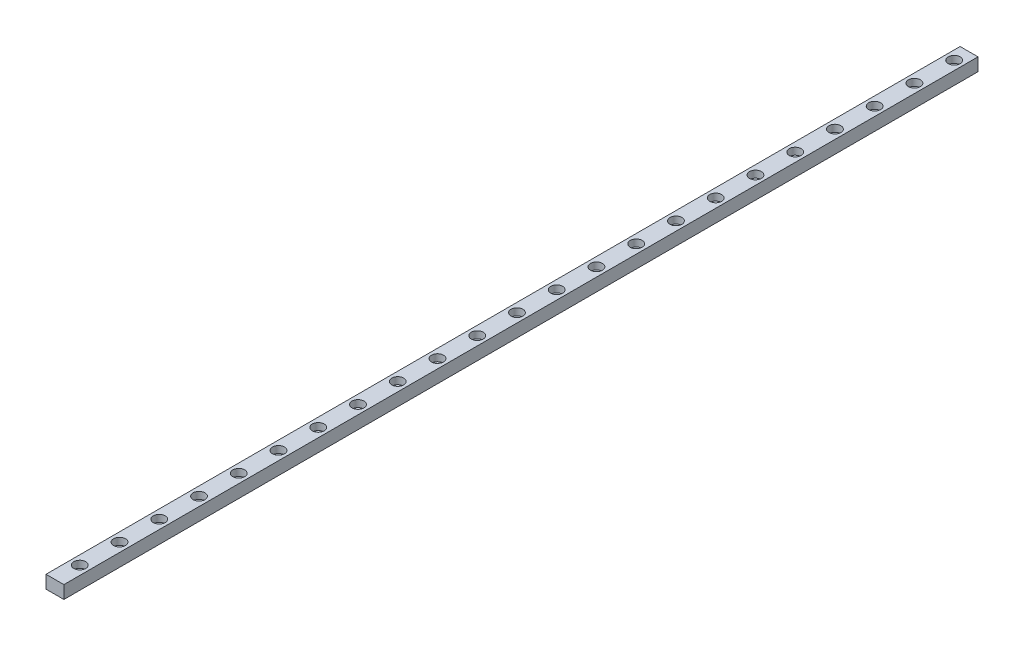
from build123d import *

# Parameters (mm, degrees)
SKETCH_1_W          = 9
SKETCH_1_H          = 6.5
EXTRUDE_1_DEPTH     = 460
SKETCH_2_R          = 1.750000006
CUT_EXTRUDE_1_DEPTH = 371.819449874
SKETCH_3_R          = 3.000000006
CUT_EXTRUDE_2_DEPTH = 3.5


with BuildPart() as part:
    # 草图1 → 凸台-拉伸1 (new body)
    with BuildSketch(Plane.XY.offset(-89.264832522)):
        Rectangle(SKETCH_1_W, SKETCH_1_H)
    extrude(amount=EXTRUDE_1_DEPTH)

    # 草图2 → 切除-拉伸1 (cut, through all)
    with BuildSketch(Plane(origin=(0, 3.25, 0), x_dir=(1, 0, 0), z_dir=(0, 1, 0))):
        with Locations(Location((0, 81.764832522, 0), (0, 0, 270))):
            Circle(SKETCH_2_R)
        with Locations(Location((0, 61.764832522, 0), (0, 0, 270))):
            Circle(SKETCH_2_R)
        with Locations(Location((0, 41.764832522, 0), (0, 0, 270))):
            Circle(SKETCH_2_R)
        with Locations(Location((0, 21.764832522, 0), (0, 0, 270))):
            Circle(SKETCH_2_R)
        with Locations(Location((0, 1.764832522, 0), (0, 0, 270))):
            Circle(SKETCH_2_R)
        with Locations(Location((0, -18.235167478, 0), (0, 0, 270))):
            Circle(SKETCH_2_R)
        with Locations(Location((0, -38.235167478, 0), (0, 0, 270))):
            Circle(SKETCH_2_R)
        with Locations(Location((0, -58.235167478, 0), (0, 0, 270))):
            Circle(SKETCH_2_R)
        with Locations(Location((0, -78.235167478, 0), (0, 0, 270))):
            Circle(SKETCH_2_R)
        with Locations(Location((0, -98.235167478, 0), (0, 0, 270))):
            Circle(SKETCH_2_R)
        with Locations(Location((0, -118.235167478, 0), (0, 0, 270))):
            Circle(SKETCH_2_R)
        with Locations(Location((0, -138.235167478, 0), (0, 0, 270))):
            Circle(SKETCH_2_R)
        with Locations(Location((0, -158.235167478, 0), (0, 0, 270))):
            Circle(SKETCH_2_R)
        with Locations(Location((0, -178.235167478, 0), (0, 0, 270))):
            Circle(SKETCH_2_R)
        with Locations(Location((0, -198.235167478, 0), (0, 0, 270))):
            Circle(SKETCH_2_R)
        with Locations(Location((0, -218.235167478, 0), (0, 0, 270))):
            Circle(SKETCH_2_R)
        with Locations(Location((0, -238.235167478, 0), (0, 0, 270))):
            Circle(SKETCH_2_R)
        with Locations(Location((0, -258.235167478, 0), (0, 0, 270))):
            Circle(SKETCH_2_R)
        with Locations(Location((0, -278.235167478, 0), (0, 0, 270))):
            Circle(SKETCH_2_R)
        with Locations(Location((0, -298.235167478, 0), (0, 0, 270))):
            Circle(SKETCH_2_R)
        with Locations(Location((0, -318.235167478, 0), (0, 0, 270))):
            Circle(SKETCH_2_R)
        with Locations(Location((0, -338.235167478, 0), (0, 0, 270))):
            Circle(SKETCH_2_R)
        with Locations(Location((0, -358.235167478, 0), (0, 0, 270))):
            Circle(SKETCH_2_R)
        with Locations((0, -378.235167478)):
            Circle(SKETCH_2_R)
        with Locations((0, -398.235167478)):
            Circle(SKETCH_2_R)
        with Locations((0, -418.235167478)):
            Circle(SKETCH_2_R)
        with Locations((0, -438.235167478)):
            Circle(SKETCH_2_R)
        with Locations((0, -458.235167478)):
            Circle(SKETCH_2_R)
        with Locations((0, -478.235167478)):
            Circle(SKETCH_2_R)
        with Locations((0, -498.235167478)):
            Circle(SKETCH_2_R)
        with Locations((0, -518.235167478)):
            Circle(SKETCH_2_R)
        with Locations((0, -538.235167478)):
            Circle(SKETCH_2_R)
        with Locations((0, -558.235167478)):
            Circle(SKETCH_2_R)
        with Locations((0, -578.235167478)):
            Circle(SKETCH_2_R)
        with Locations((0, -598.235167478)):
            Circle(SKETCH_2_R)
        with Locations((0, -618.235167478)):
            Circle(SKETCH_2_R)
        with Locations((0, -638.235167478)):
            Circle(SKETCH_2_R)
        with Locations((0, -658.235167478)):
            Circle(SKETCH_2_R)
        with Locations((0, -678.235167478)):
            Circle(SKETCH_2_R)
        with Locations((0, -698.235167478)):
            Circle(SKETCH_2_R)
        with Locations((0, -718.235167478)):
            Circle(SKETCH_2_R)
        with Locations((0, -738.235167478)):
            Circle(SKETCH_2_R)
        with Locations((0, -758.235167478)):
            Circle(SKETCH_2_R)
        with Locations((0, -778.235167478)):
            Circle(SKETCH_2_R)
        with Locations((0, -798.235167478)):
            Circle(SKETCH_2_R)
        with Locations((0, -818.235167478)):
            Circle(SKETCH_2_R)
        with Locations((0, -838.235167478)):
            Circle(SKETCH_2_R)
        with Locations((0, -858.235167478)):
            Circle(SKETCH_2_R)
        with Locations((0, -878.235167478)):
            Circle(SKETCH_2_R)
        with Locations((0, -898.235167478)):
            Circle(SKETCH_2_R)
        with Locations((0, -918.235167478)):
            Circle(SKETCH_2_R)
        with Locations((0, -938.235167478)):
            Circle(SKETCH_2_R)
        with Locations((0, -958.235167478)):
            Circle(SKETCH_2_R)
        with Locations((0, -978.235167478)):
            Circle(SKETCH_2_R)
        with Locations((0, -998.235167478)):
            Circle(SKETCH_2_R)
        with Locations((0, -1018.235167478)):
            Circle(SKETCH_2_R)
        with Locations((0, -1038.235167478)):
            Circle(SKETCH_2_R)
        with Locations((0, -1058.235167478)):
            Circle(SKETCH_2_R)
        with Locations((0, -1078.235167478)):
            Circle(SKETCH_2_R)
        with Locations((0, -1098.235167478)):
            Circle(SKETCH_2_R)
    extrude(amount=-CUT_EXTRUDE_1_DEPTH, mode=Mode.SUBTRACT)

    # 草图3 → 切除-拉伸2 (cut)
    with BuildSketch(Plane(origin=(0, 3.25, 0), x_dir=(1, 0, 0), z_dir=(0, 1, 0))):
        with Locations(Location((0, 81.764832522, 0), (0, 0, 270))):
            Circle(SKETCH_3_R)
        with Locations(Location((0, 61.764832522, 0), (0, 0, 270))):
            Circle(SKETCH_3_R)
        with Locations(Location((0, 41.764832522, 0), (0, 0, 270))):
            Circle(SKETCH_3_R)
        with Locations(Location((0, 21.764832522, 0), (0, 0, 270))):
            Circle(SKETCH_3_R)
        with Locations(Location((0, 1.764832522, 0), (0, 0, 270))):
            Circle(SKETCH_3_R)
        with Locations(Location((0, -18.235167478, 0), (0, 0, 270))):
            Circle(SKETCH_3_R)
        with Locations(Location((0, -38.235167478, 0), (0, 0, 270))):
            Circle(SKETCH_3_R)
        with Locations(Location((0, -58.235167478, 0), (0, 0, 270))):
            Circle(SKETCH_3_R)
        with Locations(Location((0, -78.235167478, 0), (0, 0, 270))):
            Circle(SKETCH_3_R)
        with Locations(Location((0, -98.235167478, 0), (0, 0, 270))):
            Circle(SKETCH_3_R)
        with Locations(Location((0, -118.235167478, 0), (0, 0, 270))):
            Circle(SKETCH_3_R)
        with Locations(Location((0, -138.235167478, 0), (0, 0, 270))):
            Circle(SKETCH_3_R)
        with Locations(Location((0, -158.235167478, 0), (0, 0, 270))):
            Circle(SKETCH_3_R)
        with Locations(Location((0, -178.235167478, 0), (0, 0, 270))):
            Circle(SKETCH_3_R)
        with Locations(Location((0, -198.235167478, 0), (0, 0, 270))):
            Circle(SKETCH_3_R)
        with Locations(Location((0, -218.235167478, 0), (0, 0, 270))):
            Circle(SKETCH_3_R)
        with Locations(Location((0, -238.235167478, 0), (0, 0, 270))):
            Circle(SKETCH_3_R)
        with Locations(Location((0, -258.235167478, 0), (0, 0, 270))):
            Circle(SKETCH_3_R)
        with Locations(Location((0, -278.235167478, 0), (0, 0, 270))):
            Circle(SKETCH_3_R)
        with Locations(Location((0, -298.235167478, 0), (0, 0, 270))):
            Circle(SKETCH_3_R)
        with Locations(Location((0, -318.235167478, 0), (0, 0, 270))):
            Circle(SKETCH_3_R)
        with Locations(Location((0, -338.235167478, 0), (0, 0, 270))):
            Circle(SKETCH_3_R)
        with Locations(Location((0, -358.235167478, 0), (0, 0, 270))):
            Circle(SKETCH_3_R)
        with Locations((0, -378.235167478)):
            Circle(SKETCH_3_R)
        with Locations((0, -398.235167478)):
            Circle(SKETCH_3_R)
        with Locations((0, -418.235167478)):
            Circle(SKETCH_3_R)
        with Locations((0, -438.235167478)):
            Circle(SKETCH_3_R)
        with Locations((0, -458.235167478)):
            Circle(SKETCH_3_R)
        with Locations((0, -478.235167478)):
            Circle(SKETCH_3_R)
        with Locations((0, -498.235167478)):
            Circle(SKETCH_3_R)
        with Locations((0, -518.235167478)):
            Circle(SKETCH_3_R)
        with Locations((0, -538.235167478)):
            Circle(SKETCH_3_R)
        with Locations((0, -558.235167478)):
            Circle(SKETCH_3_R)
        with Locations((0, -578.235167478)):
            Circle(SKETCH_3_R)
        with Locations((0, -598.235167478)):
            Circle(SKETCH_3_R)
        with Locations((0, -618.235167478)):
            Circle(SKETCH_3_R)
        with Locations((0, -638.235167478)):
            Circle(SKETCH_3_R)
        with Locations((0, -658.235167478)):
            Circle(SKETCH_3_R)
        with Locations((0, -678.235167478)):
            Circle(SKETCH_3_R)
        with Locations((0, -698.235167478)):
            Circle(SKETCH_3_R)
        with Locations((0, -718.235167478)):
            Circle(SKETCH_3_R)
        with Locations((0, -738.235167478)):
            Circle(SKETCH_3_R)
        with Locations((0, -758.235167478)):
            Circle(SKETCH_3_R)
        with Locations((0, -778.235167478)):
            Circle(SKETCH_3_R)
        with Locations((0, -798.235167478)):
            Circle(SKETCH_3_R)
        with Locations((0, -818.235167478)):
            Circle(SKETCH_3_R)
        with Locations((0, -838.235167478)):
            Circle(SKETCH_3_R)
        with Locations((0, -858.235167478)):
            Circle(SKETCH_3_R)
        with Locations((0, -878.235167478)):
            Circle(SKETCH_3_R)
        with Locations((0, -898.235167478)):
            Circle(SKETCH_3_R)
        with Locations((0, -918.235167478)):
            Circle(SKETCH_3_R)
        with Locations((0, -938.235167478)):
            Circle(SKETCH_3_R)
        with Locations((0, -958.235167478)):
            Circle(SKETCH_3_R)
        with Locations((0, -978.235167478)):
            Circle(SKETCH_3_R)
        with Locations((0, -998.235167478)):
            Circle(SKETCH_3_R)
        with Locations((0, -1018.235167478)):
            Circle(SKETCH_3_R)
        with Locations((0, -1038.235167478)):
            Circle(SKETCH_3_R)
        with Locations((0, -1058.235167478)):
            Circle(SKETCH_3_R)
        with Locations((0, -1078.235167478)):
            Circle(SKETCH_3_R)
        with Locations((0, -1098.235167478)):
            Circle(SKETCH_3_R)
    extrude(amount=-CUT_EXTRUDE_2_DEPTH, mode=Mode.SUBTRACT)


solid = part.part
